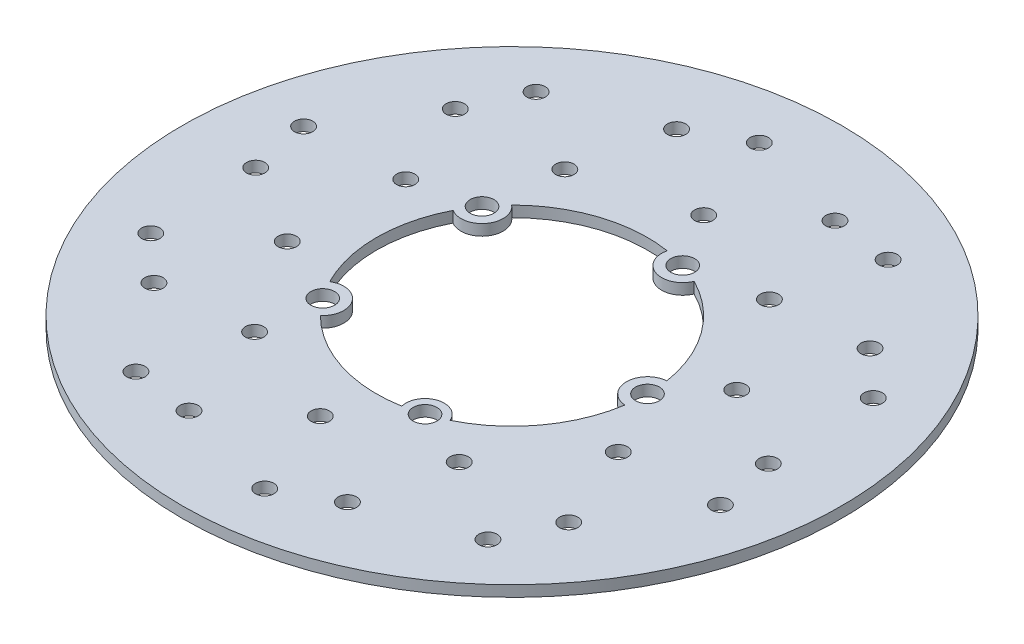
from build123d import *

# Parameters (mm, degrees)
SKETCH1_R           = 90
SKETCH1_R_2         = 3.25
BOSS_EXTRUDE1_DEPTH = 3
SKETCH2_R           = 2.5
CUT_EXTRUDE1_DEPTH  = 3


with BuildPart() as part:
    # Sketch1 → Boss-Extrude1 (new body)
    with BuildSketch(Plane(origin=(0, 0, 0), x_dir=(1, 0, 0), z_dir=(0, 1, 0))):
        with Locations(Location((0, 0, 0), (0, 0, 270))):
            Circle(SKETCH1_R)
        with Locations(Location((37, 0, 0), (0, 0, 270))):
            Circle(SKETCH1_R_2, mode=Mode.SUBTRACT)
        with Locations(Location((11.433628792, -35.189091103, 0), (0, 0, 270))):
            Circle(SKETCH1_R_2, mode=Mode.SUBTRACT)
        with Locations(Location((-29.933628792, -21.748054335, 0), (0, 0, 270))):
            Circle(SKETCH1_R_2, mode=Mode.SUBTRACT)
        with Locations(Location((-29.933628792, 21.748054335, 0), (0, 0, 270))):
            Circle(SKETCH1_R_2, mode=Mode.SUBTRACT)
        with Locations(Location((11.433628792, 35.189091103, 0), (0, 0, 270))):
            Circle(SKETCH1_R_2, mode=Mode.SUBTRACT)
        with BuildLine():
            ThreePointArc((-32.941714384, 16.847654242), (-37, 0), (-32.941714384, -16.847654242))
            ThreePointArc((-32.941714384, -16.847654242), (-25.281781074, -18.368289134), (-26.202620919, -26.123220647))
            ThreePointArc((-26.202620919, -26.123220647), (-11.194944129, -35.265751459), (6.338065362, -36.453105869))
            ThreePointArc((6.338065362, -36.453105869), (9.811289571, -30.196044392), (16.298995441, -33.216603493))
            ThreePointArc((16.298995441, -33.216603493), (29.78558867, -21.95036919), (36.553209459, -5.732615303))
            ThreePointArc((36.553209459, -5.732615303), (31.25, 0), (36.553209459, 5.732615303))
            ThreePointArc((36.553209459, 5.732615303), (29.933628792, 21.748054335), (16.747604061, 32.992692497))
            ThreePointArc((16.747604061, 32.992692497), (9.656781074, 29.720516134), (5.843521783, 36.535643599))
            ThreePointArc((5.843521783, 36.535643599), (-11.433628792, 35.189091103), (-26.202620919, 26.123220647))
            ThreePointArc((-26.202620919, 26.123220647), (-25.281781074, 18.368289134), (-32.941714384, 16.847654242))
        make_face(mode=Mode.SUBTRACT)
    extrude(amount=BOSS_EXTRUDE1_DEPTH)

    # Sketch2 → Cut-Extrude1 (cut)
    with BuildSketch(Plane(origin=(0, 3, 0), x_dir=(1, 0, 0), z_dir=(0, 1, 0))):
        with Locations(Location((70, 0, 0), (0, 0, 270))):
            Circle(SKETCH2_R)
        with Locations(Location((48.244210623, 13.133778641, 0), (0, 0, 270))):
            Circle(SKETCH2_R)
        with Locations(Location((68.806307277, 29.844464796, 0), (0, 0, 270))):
            Circle(SKETCH2_R)
        with Locations(Location((73.207608177, -16.298653474, 0), (0, 0, 270))):
            Circle(SKETCH2_R)
        with Locations(Location((46.750227666, -17.731785391, 0), (0, 0, 270))):
            Circle(SKETCH2_R)
        with Locations(Location((56.631189606, -41.14496766, 0), (0, 0, 270))):
            Circle(SKETCH2_R)
        with Locations(Location((49.646090988, -56.216240088, 0), (0, 0, 270))):
            Circle(SKETCH2_R)
        with Locations(Location((27.399246723, -41.824410086, 0), (0, 0, 270))):
            Circle(SKETCH2_R)
        with Locations(Location((21.631189606, -66.573956141, 0), (0, 0, 270))):
            Circle(SKETCH2_R)
        with Locations(Location((7.121454451, -74.661133708, 0), (0, 0, 270))):
            Circle(SKETCH2_R)
        with Locations(Location((-2.417315202, -49.941531687, 0), (0, 0, 270))):
            Circle(SKETCH2_R)
        with Locations(Location((-21.631189606, -66.573956141, 0), (0, 0, 270))):
            Circle(SKETCH2_R)
        with Locations(Location((-38.123335637, -64.58801189, 0), (0, 0, 270))):
            Circle(SKETCH2_R)
        with Locations(Location((-31.310544882, -38.982685634, 0), (0, 0, 270))):
            Circle(SKETCH2_R)
        with Locations(Location((-56.631189606, -41.14496766, 0), (0, 0, 270))):
            Circle(SKETCH2_R)
        with Locations(Location((-68.806307277, -29.844464796, 0), (0, 0, 270))):
            Circle(SKETCH2_R)
        with Locations(Location((-48.244210623, -13.133778641, 0), (0, 0, 270))):
            Circle(SKETCH2_R)
        with Locations(Location((-70, 0, 0), (0, 0, 270))):
            Circle(SKETCH2_R)
        with Locations(Location((-73.207608177, 16.298653474, 0), (0, 0, 270))):
            Circle(SKETCH2_R)
        with Locations(Location((-46.750227666, 17.731785391, 0), (0, 0, 270))):
            Circle(SKETCH2_R)
        with Locations(Location((-56.631189606, 41.14496766, 0), (0, 0, 270))):
            Circle(SKETCH2_R)
        with Locations(Location((-49.646090988, 56.216240088, 0), (0, 0, 270))):
            Circle(SKETCH2_R)
        with Locations(Location((-27.399246723, 41.824410086, 0), (0, 0, 270))):
            Circle(SKETCH2_R)
        with Locations(Location((-21.631189606, 66.573956141, 0), (0, 0, 270))):
            Circle(SKETCH2_R)
        with Locations(Location((-7.121454451, 74.661133708, 0), (0, 0, 270))):
            Circle(SKETCH2_R)
        with Locations(Location((2.417315202, 49.941531687, 0), (0, 0, 270))):
            Circle(SKETCH2_R)
        with Locations(Location((21.631189606, 66.573956141, 0), (0, 0, 270))):
            Circle(SKETCH2_R)
        with Locations(Location((38.123335637, 64.58801189, 0), (0, 0, 270))):
            Circle(SKETCH2_R)
        with Locations(Location((31.310544882, 38.982685634, 0), (0, 0, 270))):
            Circle(SKETCH2_R)
        with Locations(Location((56.631189606, 41.14496766, 0), (0, 0, 270))):
            Circle(SKETCH2_R)
    extrude(amount=-CUT_EXTRUDE1_DEPTH, mode=Mode.SUBTRACT)


solid = part.part
